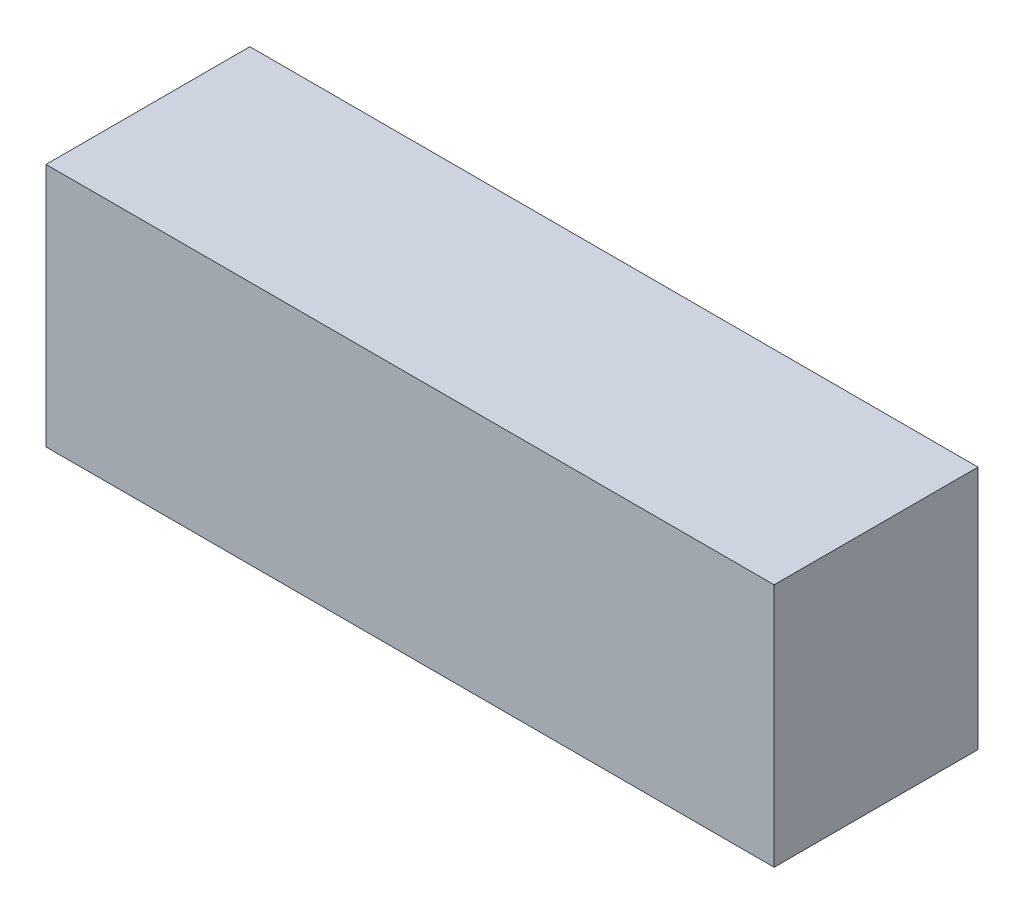
from build123d import *

# Parameters (mm, degrees)
ESQUISSE1_W        = 125
ESQUISSE1_H        = 42
BOSS_EXTRU_1_DEPTH = 35


with BuildPart() as part:
    # Esquisse1 → Boss.-Extru.1 (new body)
    with BuildSketch(Plane.XY):
        with Locations((-62.5, 21)):
            Rectangle(ESQUISSE1_W, ESQUISSE1_H)
    extrude(amount=BOSS_EXTRU_1_DEPTH)


solid = part.part
